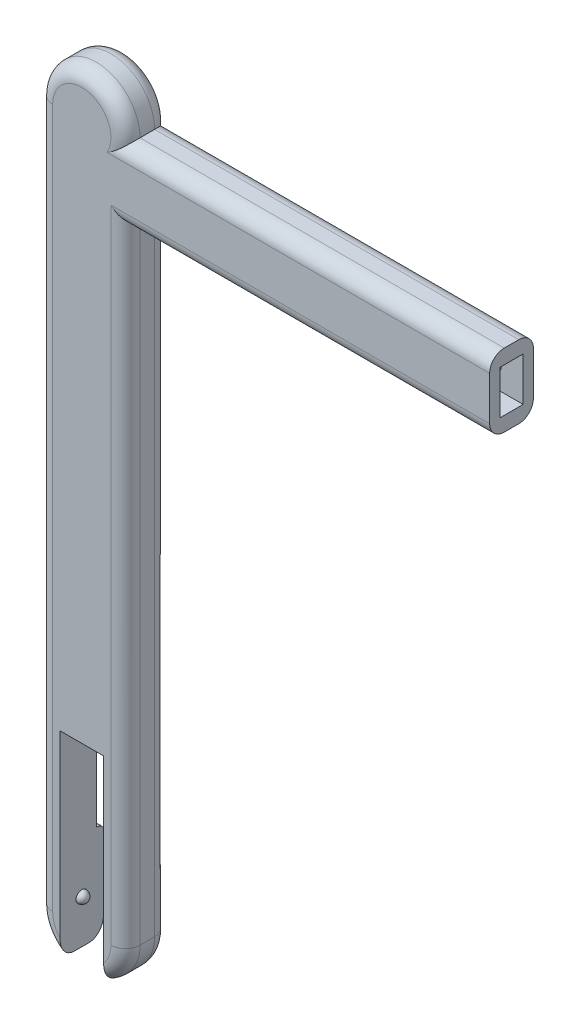
from build123d import *

# Parameters (mm, degrees)
BOSS_EXTRUDE1_DEPTH = 15
FILLET1_R           = 5
SKETCH2_W           = 8
SKETCH2_H           = 15
CUT_EXTRUDE1_DEPTH  = 100
SKETCH3_W           = 15
SKETCH3_H           = 70
CUT_EXTRUDE3_DEPTH  = 100
CUT_EXTRUDE4_DEPTH  = 3.75
SKETCH9_R           = 2.5
CUT_EXTRUDE5_DEPTH  = 7.5
SKETCH10_W          = 2.5
SKETCH10_H          = 90
CUT_EXTRUDE6_DEPTH  = 218.431134071
FILLET2_R           = 2
BOSS_EXTRUDE2_DEPTH = 19
SKETCH12_W          = 13.011456799
SKETCH12_H          = 10.932703346
CUT_EXTRUDE7_DEPTH  = 7


with BuildPart() as part:
    # Sketch1 → Boss-Extrude1 (new body)
    with BuildSketch(Plane.XY):
        with BuildLine():
            Line((-15, -103.255813953), (-15, 136.744186047))
            ThreePointArc((-15, 136.744186047), (0, 151.744186047), (15, 136.744186047))
            Line((15, 136.744186047), (140, 136.744186047))
            Line((140, 136.744186047), (140, 111.744186047))
            Line((140, 111.744186047), (15, 111.744186047))
            Line((15, 111.744186047), (15, -103.255813953))
            ThreePointArc((15, -103.255813953), (0, -118.255813953), (-15, -103.255813953))
        make_face()
    extrude(amount=BOSS_EXTRUDE1_DEPTH)

    # Fillet1
    fillet1_edges = [part.edges().sort_by_distance(p)[0] for p in [
        (0, -118.255813953, 0),
        (77.5, 111.744186047, 15),
        (77.5, 136.744186047, 15),
        (0, 151.744186047, 15),
        (-15, 16.744186047, 15),
        (0, -118.255813953, 15),
        (-15, 16.744186047, 0),
        (0, 151.744186047, 0),
        (77.5, 136.744186047, 0),
        (15, 4.244186047, 15),
        (77.5, 111.744186047, 0),
        (15, 4.244186047, 0),
    ]]
    fillet(fillet1_edges, radius=FILLET1_R)

    # Sketch2 → Cut-Extrude1 (cut)
    with BuildSketch(Plane(origin=(140, 0, 0), x_dir=(0, 0, -1), z_dir=(1, 0, 0))):
        with Locations((-7.5, 124.244186047)):
            Rectangle(SKETCH2_W, SKETCH2_H)
    extrude(amount=-CUT_EXTRUDE1_DEPTH, mode=Mode.SUBTRACT)

    # Sketch3 → Cut-Extrude3 (cut)
    with BuildSketch(Plane.XY.offset(15)):
        with Locations((0, -83.255813953)):
            Rectangle(SKETCH3_W, SKETCH3_H)
    extrude(amount=-CUT_EXTRUDE3_DEPTH, mode=Mode.SUBTRACT)

    # Sketch6 → Revolve1 (revolve)
    with BuildSketch(Plane.XY.offset(7.5)):
        with BuildLine():
            Line((-7.5, -101.255813953), (-5.5, -101.255813953))
            ThreePointArc((-5.5, -101.255813953), (-6.085786438, -99.841600391), (-7.5, -99.255813953))
            Line((-7.5, -99.255813953), (-7.5, -101.255813953))
        make_face()
        with BuildLine():
            Line((7.5, -101.255813953), (5.5, -101.255813953))
            ThreePointArc((5.5, -101.255813953), (6.085786438, -99.841600391), (7.5, -99.255813953))
            Line((7.5, -99.255813953), (7.5, -101.255813953))
        make_face()
    revolve(axis=Axis((22.79505848, -101.255813953, 7.5), (-1, 0, 0)))

    # Sketch8 → Cut-Extrude4 (cut, symmetric)
    with BuildSketch(Plane(origin=(0, 0, 0), x_dir=(0, 0, -1), z_dir=(1, 0, 0))):
        Polygon((-7.5, 91.744186047), (0, 86.49262951), (0, 76.49262951), (-7.5, 81.744186047), align=None)
        Polygon((0, 56.49262951), (0, 66.49262951), (-7.5, 71.744186047), (-7.5, 61.744186047), align=None)
        Polygon((0, 36.49262951), (0, 46.49262951), (-7.5, 51.744186047), (-7.5, 41.744186047), align=None)
    extrude(amount=CUT_EXTRUDE4_DEPTH, both=True, mode=Mode.SUBTRACT)

    # Sketch9 → Cut-Extrude5 (cut)
    with BuildSketch(Plane(origin=(0, 0, 0), x_dir=(-1, 0, 0), z_dir=(0, 0, -1))):
        with Locations((-130, 124.244186047)):
            Circle(SKETCH9_R)
        with Locations((-110, 124.244186047)):
            Circle(SKETCH9_R)
        with Locations((-90, 124.244186047)):
            Circle(SKETCH9_R)
        with Locations((-70, 124.244186047)):
            Circle(SKETCH9_R)
        with Locations((-50, 124.244186047)):
            Circle(SKETCH9_R)
    extrude(amount=-CUT_EXTRUDE5_DEPTH, mode=Mode.SUBTRACT)

    # Sketch10 → Cut-Extrude6 (cut, through all)
    with BuildSketch(Plane.ZY.offset(15)):
        with Locations((1.25, -38.255813953)):
            Rectangle(SKETCH10_W, SKETCH10_H)
    extrude(amount=-CUT_EXTRUDE6_DEPTH, mode=Mode.SUBTRACT)

    # Fillet2
    fillet2_edges = [part.edges().sort_by_distance(p)[0] for p in [
        (-12.5, 6.744186047, 0.669872981),
        (12.5, 6.744186047, 0.669872981),
        (8.75, -83.255813953, 0),
        (-8.75, -83.255813953, 0),
        (12.5, -83.255813953, 0.669872981),
        (-12.5, -83.255813953, 0.669872981),
        (0, 6.744186047, 0),
    ]]
    fillet(fillet2_edges, radius=FILLET2_R)

    # Sketch11 → Boss-Extrude2 (add)
    with BuildSketch(Plane.ZY.offset(15)):
        with BuildLine():
            Line((0, 109.244186047), (0, 101.244186047))
            ThreePointArc((0, 101.244186047), (-0.878679656, 103.36550639), (-3, 104.244186047))
            Line((-3, 104.244186047), (-7, 104.244186047))
            Line((-7, 104.244186047), (-7, 109.244186047))
            Line((-7, 109.244186047), (0, 109.244186047))
        make_face()
    extrude(amount=-BOSS_EXTRUDE2_DEPTH)

    # Sketch12 → Cut-Extrude7 (cut)
    with BuildSketch(Plane(origin=(0, 0, -7), x_dir=(-1, 0, 0), z_dir=(0, 0, -1))):
        with Locations((10.2557284, 106.179286635)):
            Rectangle(SKETCH12_W, SKETCH12_H)
    extrude(amount=-CUT_EXTRUDE7_DEPTH, mode=Mode.SUBTRACT)


solid = part.part
